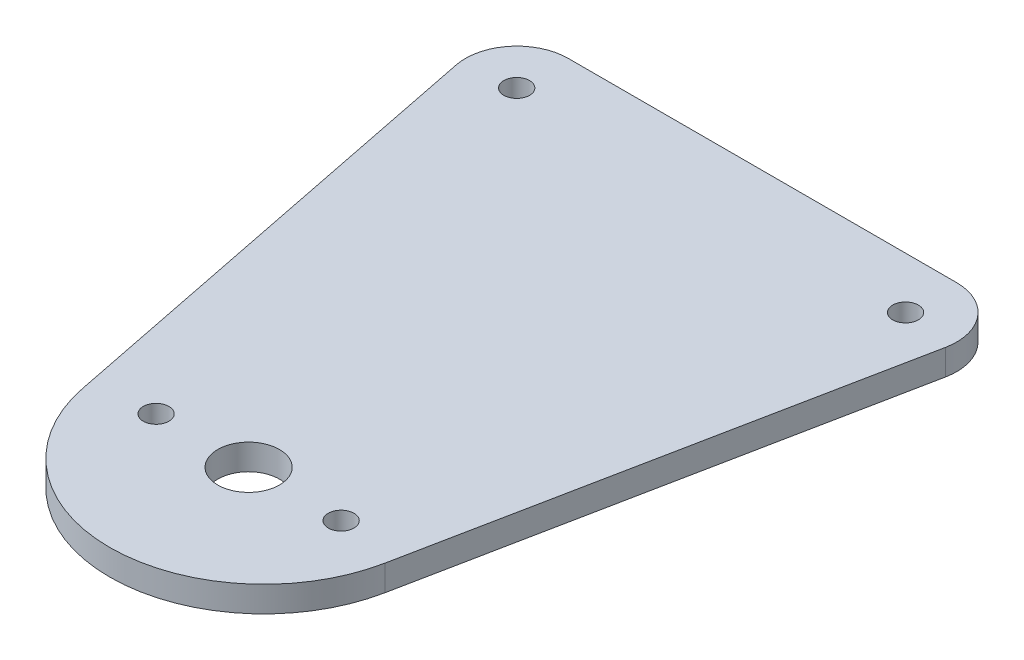
from build123d import *

# Parameters (mm, degrees)
SKETCH_2_R      = 2.5
SKETCH_2_R_2    = 6
EXTRUDE_1_DEPTH = 5


with BuildPart() as part:
    # 草图2 → 凸台-拉伸1 (new body)
    with BuildSketch(Plane(origin=(0, 0, 0), x_dir=(1, 0, 0), z_dir=(0, 1, 0))):
        with BuildLine():
            Line((25.631960973, 178.867513459), (-49.971960973, 178.867513459))
            ThreePointArc((-49.971960973, 178.867513459), (-57.705382386, 175.207402516), (-59.77776773, 166.906352108))
            Line((-59.77776773, 166.906352108), (-41.587420271, 75.954614813))
            ThreePointArc((-41.587420271, 75.954614813), (-12.17, 51.838098867), (17.247420271, 75.954614813))
            Line((17.247420271, 75.954614813), (35.43776773, 166.906352108))
            ThreePointArc((35.43776773, 166.906352108), (33.365382386, 175.207402516), (25.631960973, 178.867513459))
        make_face()
        with Locations(Location((-30.17, 78.867513459, 0), (0, 0, 270))):
            Circle(SKETCH_2_R, mode=Mode.SUBTRACT)
        with Locations(Location((5.83, 78.867513459, 0), (0, 0, 90))):
            Circle(SKETCH_2_R, mode=Mode.SUBTRACT)
        with Locations(Location((-50, 168.867513459, 0), (0, 0, 270))):
            Circle(SKETCH_2_R, mode=Mode.SUBTRACT)
        with Locations(Location((25.66, 168.867513459, 0), (0, 0, 90))):
            Circle(SKETCH_2_R, mode=Mode.SUBTRACT)
        with Locations(Location((-12.17, 78.867513459, 0), (0, 0, 270))):
            Circle(SKETCH_2_R_2, mode=Mode.SUBTRACT)
    extrude(amount=EXTRUDE_1_DEPTH)


solid = part.part
